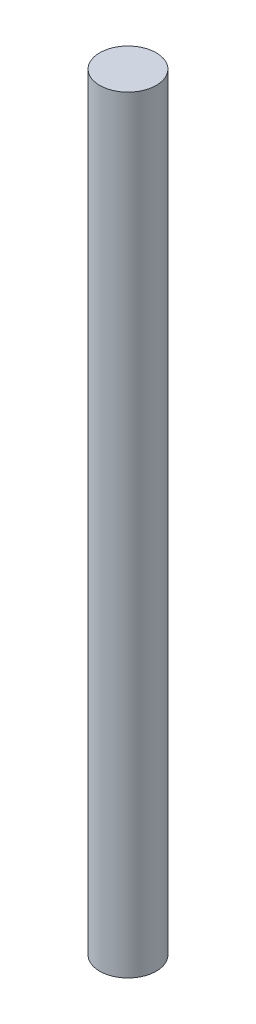
from build123d import *

# Parameters (mm, degrees)
SKETCH1_R           = 1.4
BOSS_EXTRUDE1_DEPTH = 38


with BuildPart() as part:
    # Sketch1 → Boss-Extrude1 (new body)
    with BuildSketch(Plane(origin=(0, 0, 0), x_dir=(1, 0, 0), z_dir=(0, 1, 0))):
        with Locations(Location((0, 0, 0), (0, 0, 270))):
            Circle(SKETCH1_R)
    extrude(amount=BOSS_EXTRUDE1_DEPTH)


solid = part.part
